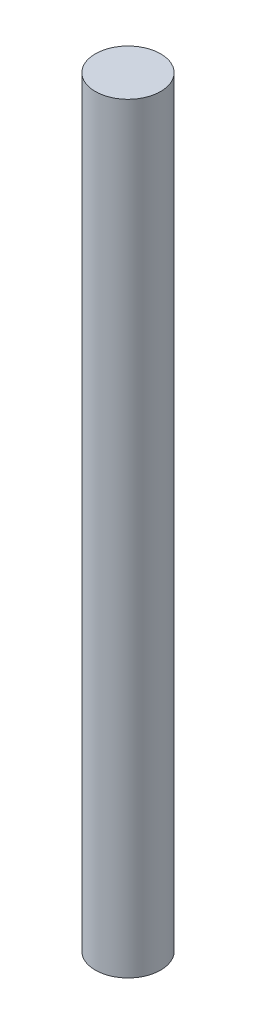
from build123d import *

# Parameters (mm, degrees)
SKETCH1_R           = 1.5875
BOSS_EXTRUDE1_DEPTH = 37


with BuildPart() as part:
    # Sketch1 → Boss-Extrude1 (new body)
    with BuildSketch(Plane(origin=(0, 0, 0), x_dir=(1, 0, 0), z_dir=(0, 1, 0))):
        with Locations(Location((0, 0, 0), (0, 0, 270))):
            Circle(SKETCH1_R)
    extrude(amount=BOSS_EXTRUDE1_DEPTH)


solid = part.part
